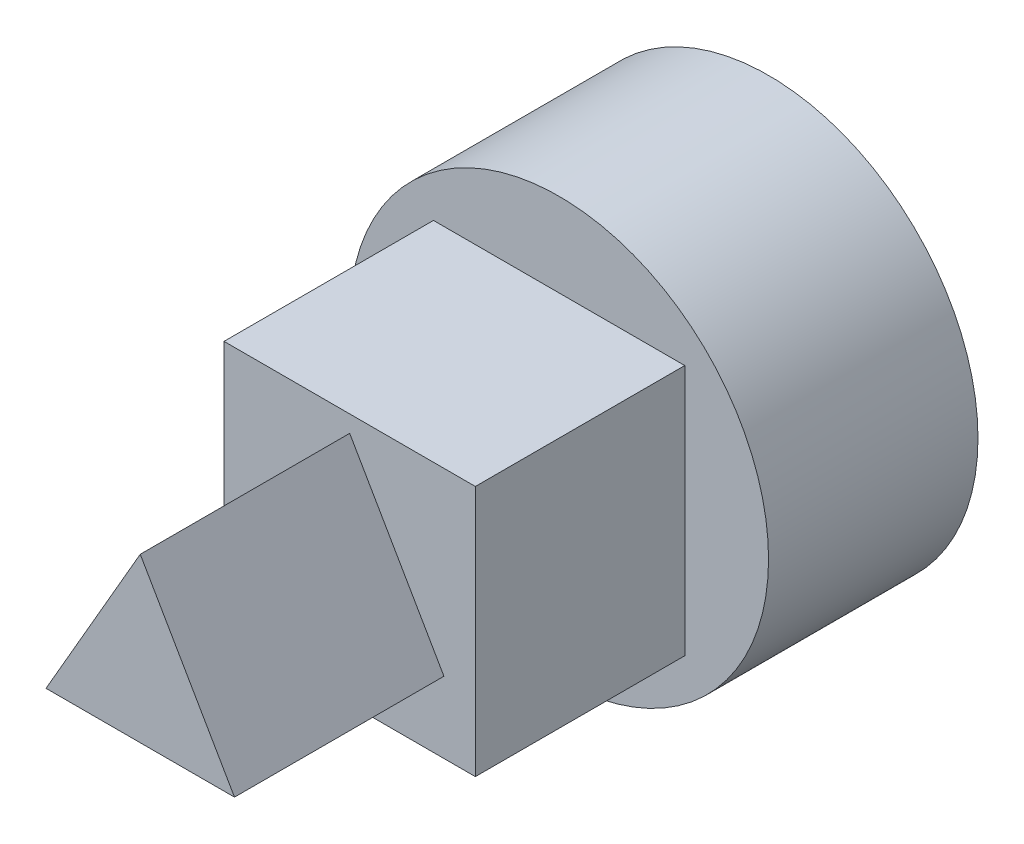
from build123d import *

# Parameters (mm, degrees)
BOSS_EXTRUDE2_DEPTH = 150
SKETCH1_4_W         = 60
SKETCH1_4_H         = 60
BOSS_EXTRUDE3_DEPTH = 100
SKETCH1_5_R         = 50
SKETCH1_5_W         = 60
SKETCH1_5_H         = 60
BOSS_EXTRUDE4_DEPTH = 50


with BuildPart() as part:
    # Sketch1 → Boss-Extrude2 (new body)
    with BuildSketch(Plane.XY):
        Polygon((22.5, -12.990381057), (0, 25.980762114), (-22.5, -12.990381057), align=None)
    extrude(amount=BOSS_EXTRUDE2_DEPTH)

    # Sketch1<4> → Boss-Extrude3 (add)
    with BuildSketch(Plane.XY):
        Rectangle(SKETCH1_4_W, SKETCH1_4_H)
        Polygon((-22.5, -12.990381057), (0, 25.980762114), (22.5, -12.990381057), align=None, mode=Mode.SUBTRACT)
    extrude(amount=BOSS_EXTRUDE3_DEPTH)

    # Sketch1<5> → Boss-Extrude4 (add)
    with BuildSketch(Plane.XY):
        Circle(SKETCH1_5_R)
        Rectangle(SKETCH1_5_W, SKETCH1_5_H, mode=Mode.SUBTRACT)
    extrude(amount=BOSS_EXTRUDE4_DEPTH)


solid = part.part
